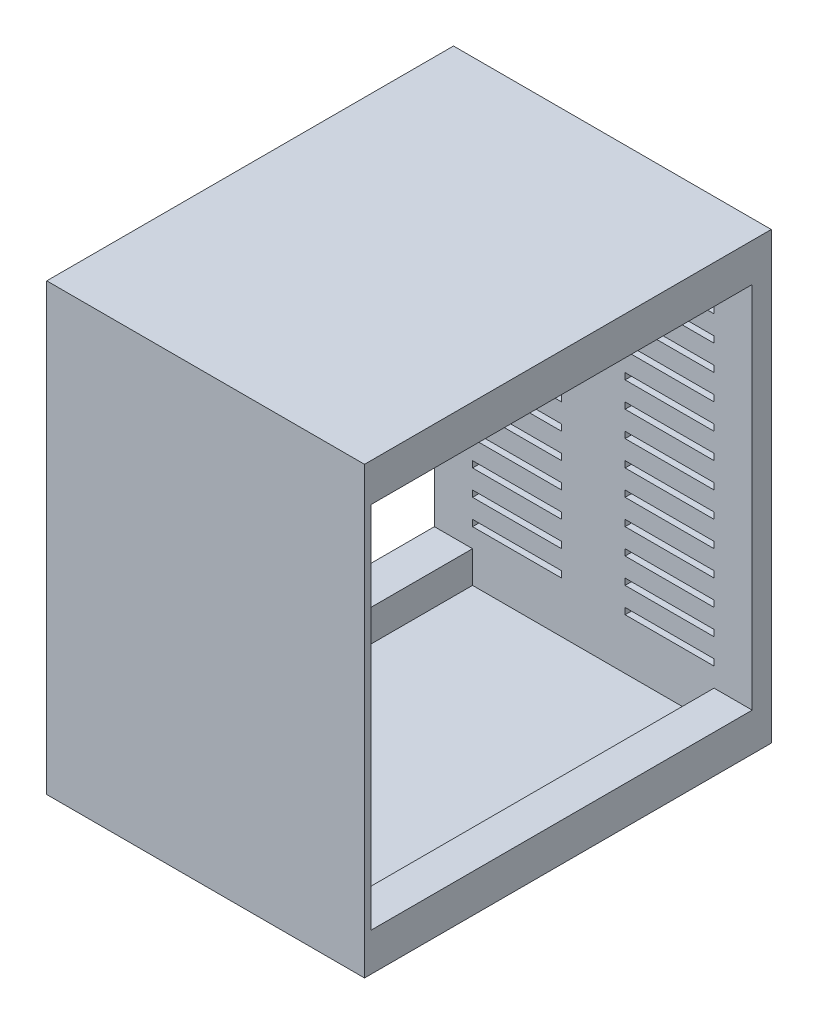
from build123d import *

# Parameters (mm, degrees)
CROQUIS1_W              = 250
CROQUIS1_H              = 350
SALIENTE_EXTRUIR2_DEPTH = 15
CROQUIS2_W              = 30
CROQUIS2_H              = 30
SALIENTE_EXTRUIR3_DEPTH = 300
CROQUIS3_W              = 250
CROQUIS3_H              = 350
SALIENTE_EXTRUIR4_DEPTH = 5
CROQUIS7_W              = 70
CROQUIS7_H              = 5
CORTAR_EXTRUIR1_DEPTH   = 20
CROQUIS8_W              = 250
CROQUIS8_H              = 320
SALIENTE_EXTRUIR5_DEPTH = 5
CROQUIS9_W              = 250
CROQUIS9_H              = 320
SALIENTE_EXTRUIR6_DEPTH = 5


with BuildPart() as part:
    # Croquis1 → Saliente-Extruir2 (new body)
    with BuildSketch(Plane.XY):
        Rectangle(CROQUIS1_W, CROQUIS1_H)
    extrude(amount=SALIENTE_EXTRUIR2_DEPTH)

    # Croquis2 → Saliente-Extruir3 (add)
    with BuildSketch(Plane.XY.offset(15)):
        with Locations((-110, 160)):
            Rectangle(CROQUIS2_W, CROQUIS2_H)
        with Locations((110, 160)):
            Rectangle(CROQUIS2_W, CROQUIS2_H)
        with Locations((-110, -160)):
            Rectangle(CROQUIS2_W, CROQUIS2_H)
        with Locations((110, -160)):
            Rectangle(CROQUIS2_W, CROQUIS2_H)
    extrude(amount=SALIENTE_EXTRUIR3_DEPTH)

    # Croquis3 → Saliente-Extruir4 (add)
    with BuildSketch(Plane.XY.offset(315)):
        Rectangle(CROQUIS3_W, CROQUIS3_H)
    extrude(amount=SALIENTE_EXTRUIR4_DEPTH)

    # Croquis7 → Cortar-Extruir1 (cut)
    with BuildSketch(Plane(origin=(0, 0, 0), x_dir=(-1, 0, 0), z_dir=(0, 0, -1))):
        with Locations((60, 132.5)):
            Rectangle(CROQUIS7_W, CROQUIS7_H)
        with Locations((-60, 132.5)):
            Rectangle(CROQUIS7_W, CROQUIS7_H)
        with Locations((60, 112.5)):
            Rectangle(CROQUIS7_W, CROQUIS7_H)
        with Locations((60, 92.5)):
            Rectangle(CROQUIS7_W, CROQUIS7_H)
        with Locations((60, 72.5)):
            Rectangle(CROQUIS7_W, CROQUIS7_H)
        with Locations((60, 52.5)):
            Rectangle(CROQUIS7_W, CROQUIS7_H)
        with Locations((60, 32.5)):
            Rectangle(CROQUIS7_W, CROQUIS7_H)
        with Locations((60, 12.5)):
            Rectangle(CROQUIS7_W, CROQUIS7_H)
        with Locations((60, -7.5)):
            Rectangle(CROQUIS7_W, CROQUIS7_H)
        with Locations((60, -27.5)):
            Rectangle(CROQUIS7_W, CROQUIS7_H)
        with Locations((60, -47.5)):
            Rectangle(CROQUIS7_W, CROQUIS7_H)
        with Locations((-60, 112.5)):
            Rectangle(CROQUIS7_W, CROQUIS7_H)
        with Locations((-60, 92.5)):
            Rectangle(CROQUIS7_W, CROQUIS7_H)
        with Locations((-60, 72.5)):
            Rectangle(CROQUIS7_W, CROQUIS7_H)
        with Locations((-60, 52.5)):
            Rectangle(CROQUIS7_W, CROQUIS7_H)
        with Locations((-60, 32.5)):
            Rectangle(CROQUIS7_W, CROQUIS7_H)
        with Locations((-60, 12.5)):
            Rectangle(CROQUIS7_W, CROQUIS7_H)
        with Locations((-60, -7.5)):
            Rectangle(CROQUIS7_W, CROQUIS7_H)
        with Locations((-60, -27.5)):
            Rectangle(CROQUIS7_W, CROQUIS7_H)
        with Locations((-60, -47.5)):
            Rectangle(CROQUIS7_W, CROQUIS7_H)
        with Locations((-60, -67.5)):
            Rectangle(CROQUIS7_W, CROQUIS7_H)
        with Locations((60, -67.5)):
            Rectangle(CROQUIS7_W, CROQUIS7_H)
        with Locations((-60, -87.5)):
            Rectangle(CROQUIS7_W, CROQUIS7_H)
        with Locations((60, -87.5)):
            Rectangle(CROQUIS7_W, CROQUIS7_H)
        with Locations((-60, -107.5)):
            Rectangle(CROQUIS7_W, CROQUIS7_H)
        with Locations((60, -107.5)):
            Rectangle(CROQUIS7_W, CROQUIS7_H)
        with Locations((-60, -127.5)):
            Rectangle(CROQUIS7_W, CROQUIS7_H)
        with Locations((60, -127.5)):
            Rectangle(CROQUIS7_W, CROQUIS7_H)
    extrude(amount=-CORTAR_EXTRUIR1_DEPTH, mode=Mode.SUBTRACT)

    # Croquis8 → Saliente-Extruir5 (add)
    with BuildSketch(Plane.XZ.offset(175)):
        with Locations((0, 160)):
            Rectangle(CROQUIS8_W, CROQUIS8_H)
    extrude(amount=-SALIENTE_EXTRUIR5_DEPTH)

    # Croquis9 → Saliente-Extruir6 (add)
    with BuildSketch(Plane(origin=(0, 175, 0), x_dir=(1, 0, 0), z_dir=(0, 1, 0))):
        with Locations((0, -160)):
            Rectangle(CROQUIS9_W, CROQUIS9_H)
    extrude(amount=-SALIENTE_EXTRUIR6_DEPTH)


solid = part.part
